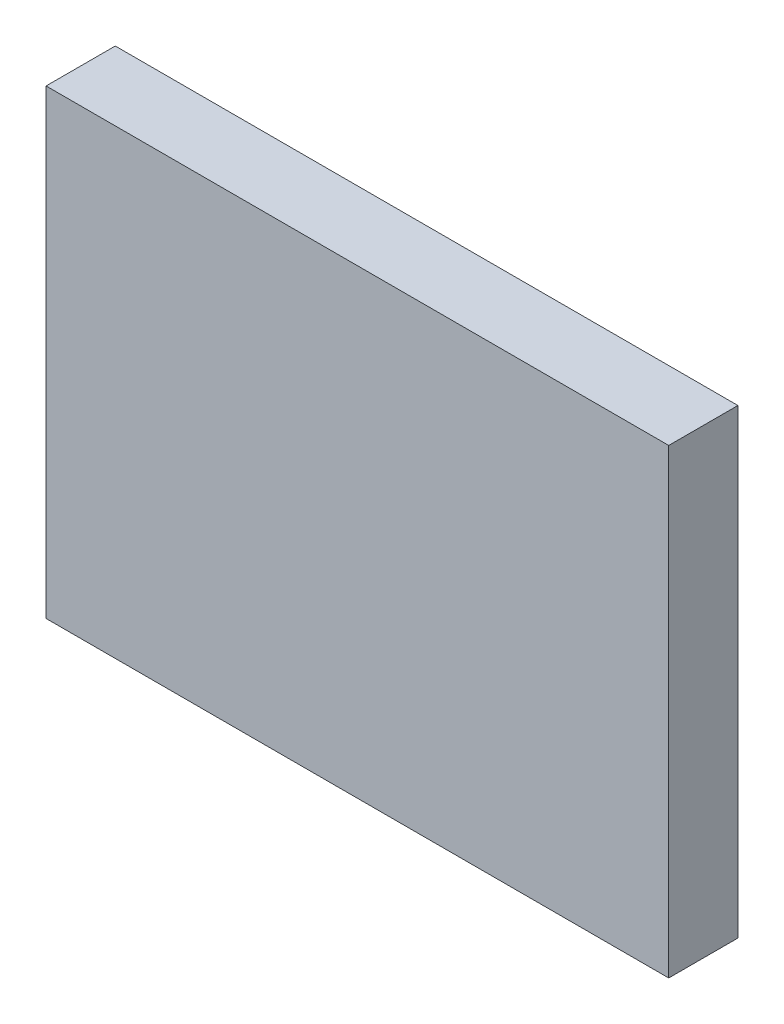
from build123d import *

# Parameters (mm, degrees)
SKETCH1_W           = 27
SKETCH1_H           = 20
BOSS_EXTRUDE1_DEPTH = 3


with BuildPart() as part:
    # Sketch1 → Boss-Extrude1 (new body)
    with BuildSketch(Plane.XY):
        with Locations((2.602444615, -4.685534591)):
            Rectangle(SKETCH1_W, SKETCH1_H)
    extrude(amount=BOSS_EXTRUDE1_DEPTH)


solid = part.part
